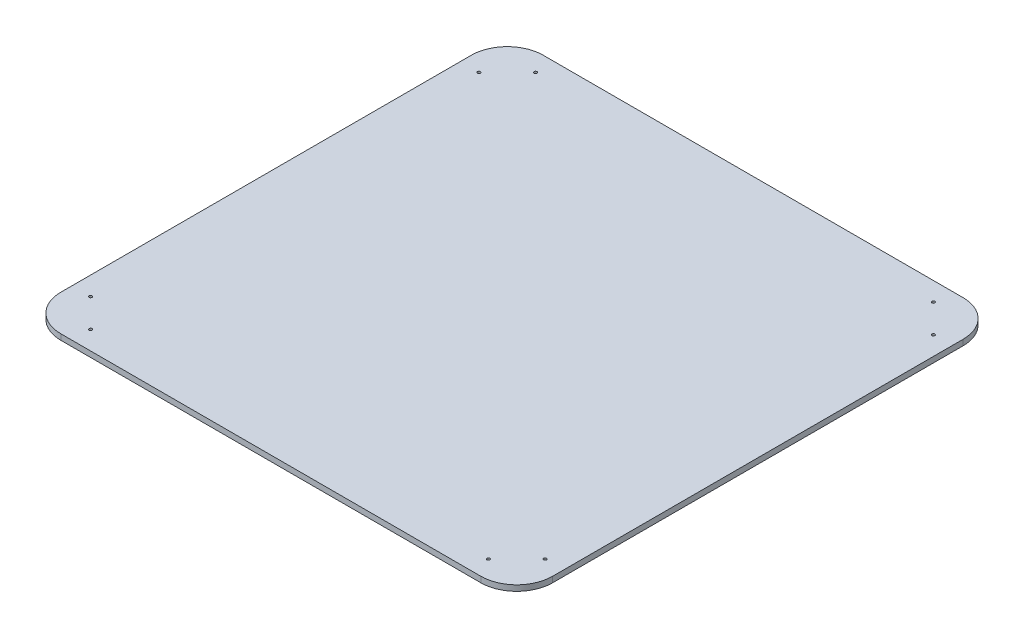
from build123d import *

# Parameters (mm, degrees)
CROQUIS1_W              = 520
CROQUIS1_H              = 510
SALIENTE_EXTRUIR1_DEPTH = 6
CROQUIS2_R              = 1.55
CORTAR_EXTRUIR1_DEPTH   = 6
REDONDEO1_R             = 38


with BuildPart() as part:
    # Croquis1 → Saliente-Extruir1 (new body)
    with BuildSketch(Plane(origin=(0, 0, 0), x_dir=(1, 0, 0), z_dir=(0, 1, 0))):
        with Locations((260, 255)):
            Rectangle(CROQUIS1_W, CROQUIS1_H)
    extrude(amount=SALIENTE_EXTRUIR1_DEPTH)

    # Croquis2 → Cortar-Extruir1 (cut)
    with BuildSketch(Plane(origin=(0, 6, 0), x_dir=(1, 0, 0), z_dir=(0, 1, 0))):
        with Locations(Location((470.25, 490.25, 0), (0, 0, 270))):
            Circle(CROQUIS2_R)
        with Locations(Location((500.25, 460.25, 0), (0, 0, 270))):
            Circle(CROQUIS2_R)
        with Locations(Location((500.25, 49.75, 0), (0, 0, 270))):
            Circle(CROQUIS2_R)
        with Locations(Location((19.75, 460.25, 0), (0, 0, 90))):
            Circle(CROQUIS2_R)
        with Locations(Location((19.75, 49.75, 0), (0, 0, 90))):
            Circle(CROQUIS2_R)
        with Locations(Location((470.25, 19.75, 0), (0, 0, 270))):
            Circle(CROQUIS2_R)
        with Locations(Location((49.75, 490.25, 0), (0, 0, 90))):
            Circle(CROQUIS2_R)
        with Locations(Location((49.75, 19.75, 0), (0, 0, 90))):
            Circle(CROQUIS2_R)
    extrude(amount=-CORTAR_EXTRUIR1_DEPTH, mode=Mode.SUBTRACT)

    # Redondeo1
    redondeo1_edges = [part.edges().sort_by_distance(p)[0] for p in [
        (0, 3, -510),
        (520, 3, -510),
        (520, 3, 0),
        (0, 3, 0),
    ]]
    fillet(redondeo1_edges, radius=REDONDEO1_R)


solid = part.part
